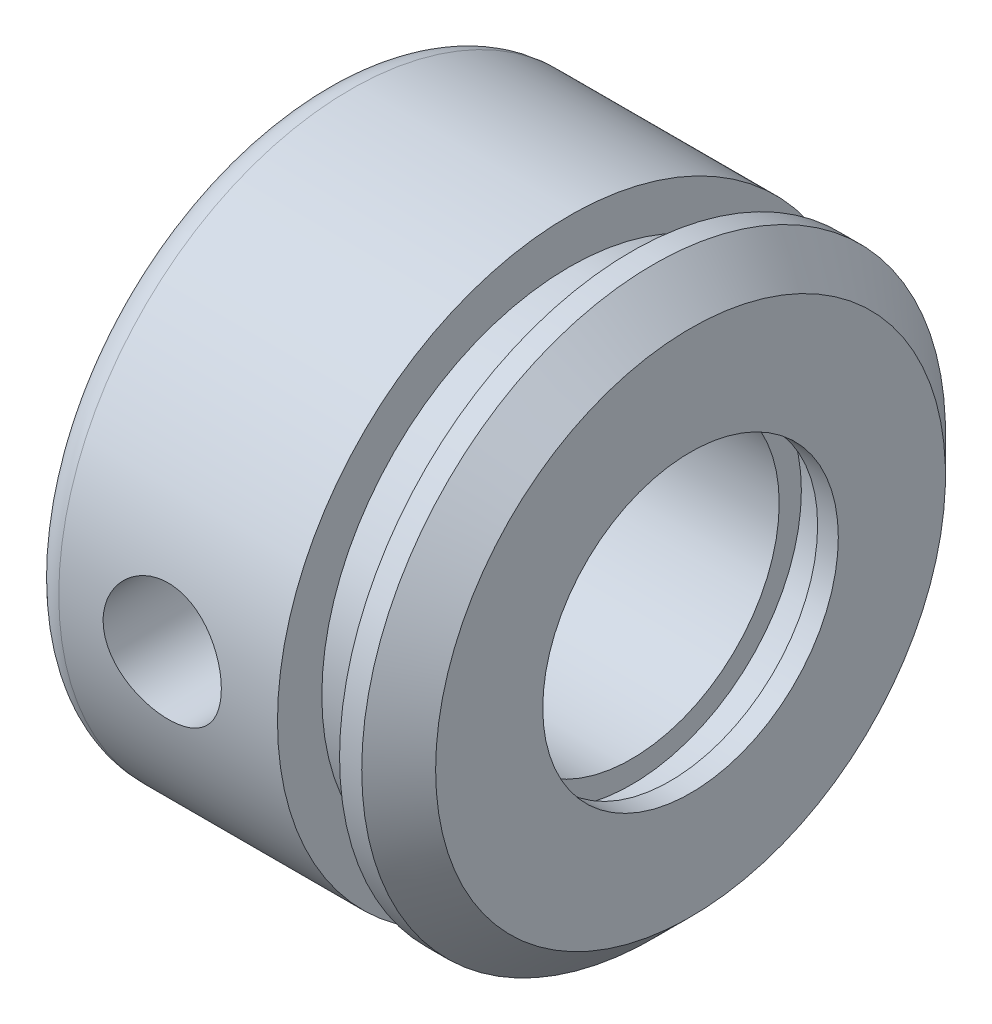
from build123d import *

# Parameters (mm, degrees)
ENL_V_MAT_EXTRU_1_DEPTH      = 37.825602507
ENL_V_MAT_EXTRU_1_DEPTH_BACK = 37.825602507
ESQUISSE2_R                  = 4
CONG_2_R                     = 2


with BuildPart() as part:
    # Esquisse1 → Base-Révolution (revolve)
    with BuildSketch(Plane.XY, mode=Mode.PRIVATE) as base_r_volution_sk:
        Polygon((-24, 10), (-24, 19.75), (-7.2, 19.75), (-7.2, 16.75), (-3, 16.75), (-3, 19.75), (-1.5, 19.75), (1, 17.25), (1, 10), (-0.4, 10), (-0.4, 11.5), (-3, 11.5), (-3, 10), align=None)
    revolve(base_r_volution_sk.sketch.rotate(Axis((-92, 0, 0), (1, 0, 0)), 90), axis=Axis((-92, 0, 0), (1, 0, 0)))

    # Esquisse2 → Enlèv. mat.-Extru.1 (cut, two sides: drawn at the far end of the back side and taken through both)
    with BuildSketch(Plane.XY.offset(-ENL_V_MAT_EXTRU_1_DEPTH_BACK)):
        with Locations((-15, 0)):
            Circle(ESQUISSE2_R)
    extrude(amount=ENL_V_MAT_EXTRU_1_DEPTH + ENL_V_MAT_EXTRU_1_DEPTH_BACK, mode=Mode.SUBTRACT)

    # Congé2
    cong_2_edges = [part.edges().sort_by_distance(p)[0] for p in [
        (-24, 0, -19.75),
    ]]
    fillet(cong_2_edges, radius=CONG_2_R)


solid = part.part
